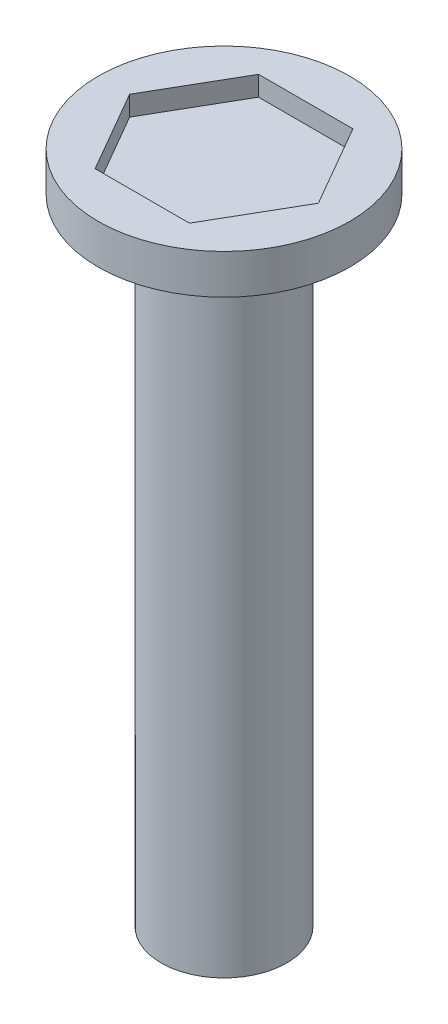
from build123d import *

# Parameters (mm, degrees)
CUT_EXTRUDE1_DEPTH = 0.5


with BuildPart() as part:
    # Sketch1 → Revolve1 (revolve)
    with BuildSketch(Plane.XY):
        Polygon((0, 0), (3.175, 0), (3.175, -17), (1.5875, -17), (1.5875, -1), (0, -1), align=None)
    revolve(axis=Axis((3.175, 0, 0), (0, -1, 0)))

    # Sketch2 → Cut-Extrude1 (cut)
    with BuildSketch(Plane(origin=(0, 0, 0), x_dir=(1, 0, 0), z_dir=(0, 1, 0))):
        Polygon((5.55625, 0), (4.365625, 2.062222993), (1.984375, 2.062222993), (0.79375, 0), (1.984375, -2.062222993), (4.365625, -2.062222993), align=None)
    extrude(amount=-CUT_EXTRUDE1_DEPTH, mode=Mode.SUBTRACT)


solid = part.part
